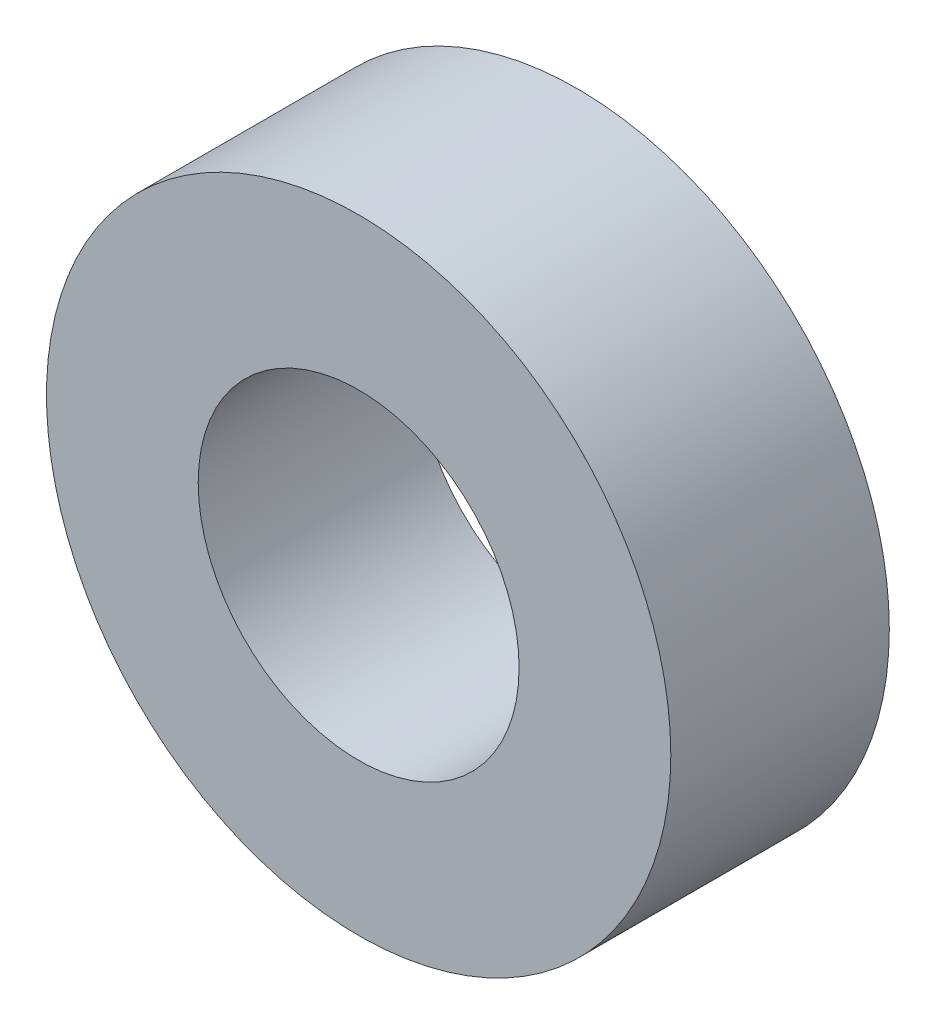
from build123d import *

# Parameters (mm, degrees)
SKETCH1_R           = 6.35
SKETCH1_R_2         = 3.2639
BOSS_EXTRUDE1_DEPTH = 4.445


with BuildPart() as part:
    # Sketch1 → Boss-Extrude1 (new body)
    with BuildSketch(Plane.XY):
        Circle(SKETCH1_R)
        Circle(SKETCH1_R_2, mode=Mode.SUBTRACT)
    extrude(amount=BOSS_EXTRUDE1_DEPTH)


solid = part.part
